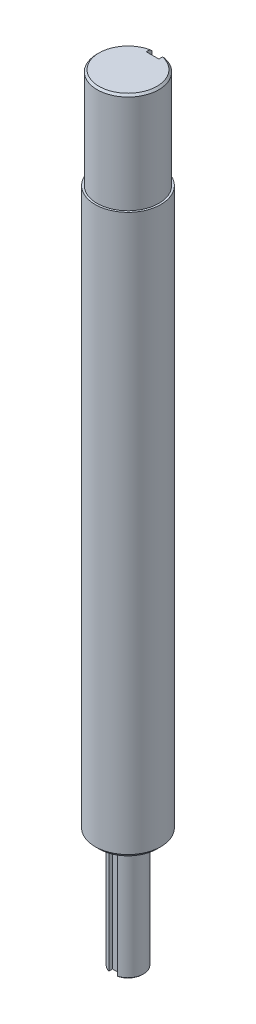
from build123d import *

# Parameters (mm, degrees)
SKETCH1_W          = 8.5
SKETCH1_H          = 201
SKETCH2_OUTSIDE_W  = 59.486
SKETCH2_OUTSIDE_H  = 59.486
SKETCH2_OUTSIDE_R  = 8
CUT_EXTRUDE1_DEPTH = 26
SKETCH3_W          = 3.25
SKETCH3_H          = 3.25
CUT_EXTRUDE2_DEPTH = 26
CHAMFER1_SIZE      = 0.5
SKETCH4_OUTSIDE_W  = 59.486
SKETCH4_OUTSIDE_H  = 59.486
SKETCH4_OUTSIDE_R  = 4
CUT_EXTRUDE3_DEPTH = 30
CHAMFER2_SIZE      = 1
SKETCH5_W          = 2.25
SKETCH5_H          = 2.25
CUT_EXTRUDE4_DEPTH = 30
CHAMFER3_SIZE      = 0.2


with BuildPart() as part:
    # Sketch1 → Revolve1 (revolve)
    with BuildSketch(Plane.XY, mode=Mode.PRIVATE) as revolve1_sk:
        with Locations((4.25, 100.5)):
            Rectangle(SKETCH1_W, SKETCH1_H)
    revolve(revolve1_sk.sketch.rotate(Axis((0, 201, 0), (0, -1, 0)), 180), axis=Axis((0, 201, 0), (0, -1, 0)))

    # Sketch2 outside → Cut-Extrude1 (cut)
    with BuildSketch(Plane(origin=(0, 201, 0), x_dir=(1, 0, 0), z_dir=(0, 1, 0))):
        Rectangle(SKETCH2_OUTSIDE_W, SKETCH2_OUTSIDE_H)
        with Locations(Location((0, 0, 0), (0, 0, 180))):
            Circle(SKETCH2_OUTSIDE_R, mode=Mode.SUBTRACT)
    extrude(amount=-CUT_EXTRUDE1_DEPTH, mode=Mode.SUBTRACT)

    # Sketch3 → Cut-Extrude2 (cut)
    with BuildSketch(Plane(origin=(0, 201, 0), x_dir=(1, 0, 0), z_dir=(0, 1, 0))):
        with Locations((0, 8)):
            Rectangle(SKETCH3_W, SKETCH3_H)
    extrude(amount=-CUT_EXTRUDE2_DEPTH, mode=Mode.SUBTRACT)

    # Chamfer1
    chamfer1_edges = [part.edges().sort_by_distance(p)[0] for p in [
        (0, 201, 8),
        (8.5, 0, 0),
    ]]
    chamfer(chamfer1_edges, length=CHAMFER1_SIZE)

    # Sketch4 outside → Cut-Extrude3 (cut)
    with BuildSketch(Plane.XZ):
        Rectangle(SKETCH4_OUTSIDE_W, SKETCH4_OUTSIDE_H)
        Circle(SKETCH4_OUTSIDE_R, mode=Mode.SUBTRACT)
    extrude(amount=-CUT_EXTRUDE3_DEPTH, mode=Mode.SUBTRACT)

    # Chamfer2
    chamfer2_edges = [part.edges().sort_by_distance(p)[0] for p in [
        (8.5, 30, 0),
    ]]
    chamfer(chamfer2_edges, length=CHAMFER2_SIZE)

    # Sketch5 → Cut-Extrude4 (cut)
    with BuildSketch(Plane.XZ):
        with Locations((0, 4)):
            Rectangle(SKETCH5_W, SKETCH5_H)
    extrude(amount=-CUT_EXTRUDE4_DEPTH, mode=Mode.SUBTRACT)

    # Chamfer3
    chamfer3_edges = [part.edges().sort_by_distance(p)[0] for p in [
        (0, 0, -4),
        (-1.125, 0, 3.356769067),
        (0, 0, 2.875),
        (1.125, 0, 3.356769067),
    ]]
    chamfer(chamfer3_edges, length=CHAMFER3_SIZE)


solid = part.part
